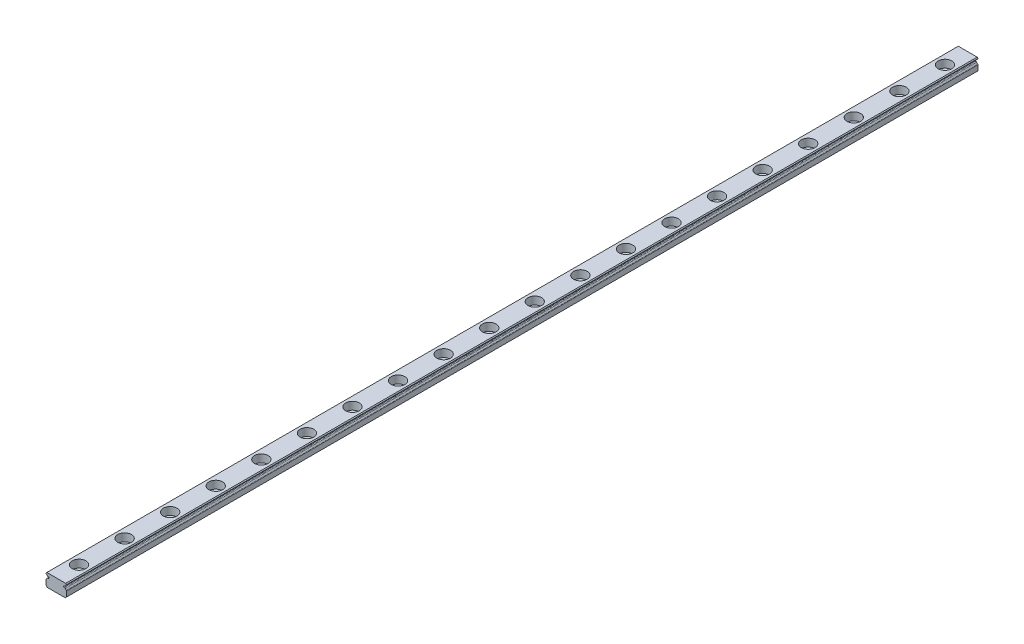
from build123d import *

# Parameters (mm, degrees)
SKETCH4_W                                           = 9
SKETCH4_H                                           = 5.6
BOSS_EXTRUDE1_DEPTH                                 = 400
CUT_EXTRUDE1_DEPTH                                  = 401.064507299
FILLET1_R                                           = 0.3
CHAMFER1_SIZE                                       = 0.36
CHAMFER2_SIZE                                       = 0.56
CBORE_FOR_M3_HEX_SOCKET_HEAD_CAP_SCREW1_D           = 3.5
CBORE_FOR_M3_HEX_SOCKET_HEAD_CAP_SCREW1_CBORE_D     = 6
CBORE_FOR_M3_HEX_SOCKET_HEAD_CAP_SCREW1_CBORE_DEPTH = 3.4
LPATTERN1_COUNT                                     = 20
LPATTERN1_PITCH                                     = 20


with BuildPart() as part:
    # Sketch4 → Boss-Extrude1 (new body)
    with BuildSketch(Plane.XY):
        with Locations((0, -2.8)):
            Rectangle(SKETCH4_W, SKETCH4_H)
    extrude(amount=BOSS_EXTRUDE1_DEPTH)

    # Sketch5 → Cut-Extrude1 (cut, through all)
    with BuildSketch(Plane.XY):
        with BuildLine():
            ThreePointArc((-3.824592593, -1.501901312), (-5.92, -1.6), (-3.824592593, -1.698098688))
            ThreePointArc((-3.824592593, -1.698098688), (-3.2, -1.6), (-3.824592593, -1.501901312))
        make_face()
    cut_extrude1 = extrude(amount=CUT_EXTRUDE1_DEPTH, mode=Mode.SUBTRACT)

    # Mirror3: Cut-Extrude1 across plane
    add(cut_extrude1.mirror(Plane(origin=(0, 0, 0), x_dir=(0, 0, 1), z_dir=(1, 0, 0))), mode=Mode.SUBTRACT)

    # Fillet1
    fillet1_edges = [part.edges().sort_by_distance(p)[0] for p in [
        (-3.824592593, -1.501901312, 200),
        (-3.824592593, -1.698098688, 200),
        (-4.5, -2.58264948, 200),
        (-4.5, -0.61735052, 200),
        (4.5, -0.61735052, 200),
        (4.5, -2.58264948, 200),
        (3.824592593, -1.698098688, 200),
        (3.824592593, -1.501901312, 200),
    ]]
    fillet(fillet1_edges, radius=FILLET1_R)

    # Chamfer1
    chamfer1_edges = [part.edges().sort_by_distance(p)[0] for p in [
        (-4.5, 0, 200),
        (4.5, 0, 200),
    ]]
    chamfer(chamfer1_edges, length=CHAMFER1_SIZE)

    # Chamfer2
    chamfer2_edges = [part.edges().sort_by_distance(p)[0] for p in [
        (4.5, -5.6, 200),
        (-4.5, -5.6, 200),
    ]]
    chamfer(chamfer2_edges, length=CHAMFER2_SIZE)

    # CBORE for M3 Hex Socket Head Cap Screw1 (through all)
    with Locations(Plane(origin=(0, 0, 0), x_dir=(1, 0, 0), z_dir=(0, 1, 0))):
        with Locations((0, -10)):
            cbore_for_m3_hex_socket_head_cap_screw1 = CounterBoreHole(CBORE_FOR_M3_HEX_SOCKET_HEAD_CAP_SCREW1_D / 2, CBORE_FOR_M3_HEX_SOCKET_HEAD_CAP_SCREW1_CBORE_D / 2, CBORE_FOR_M3_HEX_SOCKET_HEAD_CAP_SCREW1_CBORE_DEPTH)

    # LPattern1: CBORE for M3 Hex Socket Head Cap Screw1 ×20
    with Locations(*[(0, 0, i * LPATTERN1_PITCH) for i in range(1, LPATTERN1_COUNT)]):
        add(cbore_for_m3_hex_socket_head_cap_screw1, mode=Mode.SUBTRACT)


solid = part.part
